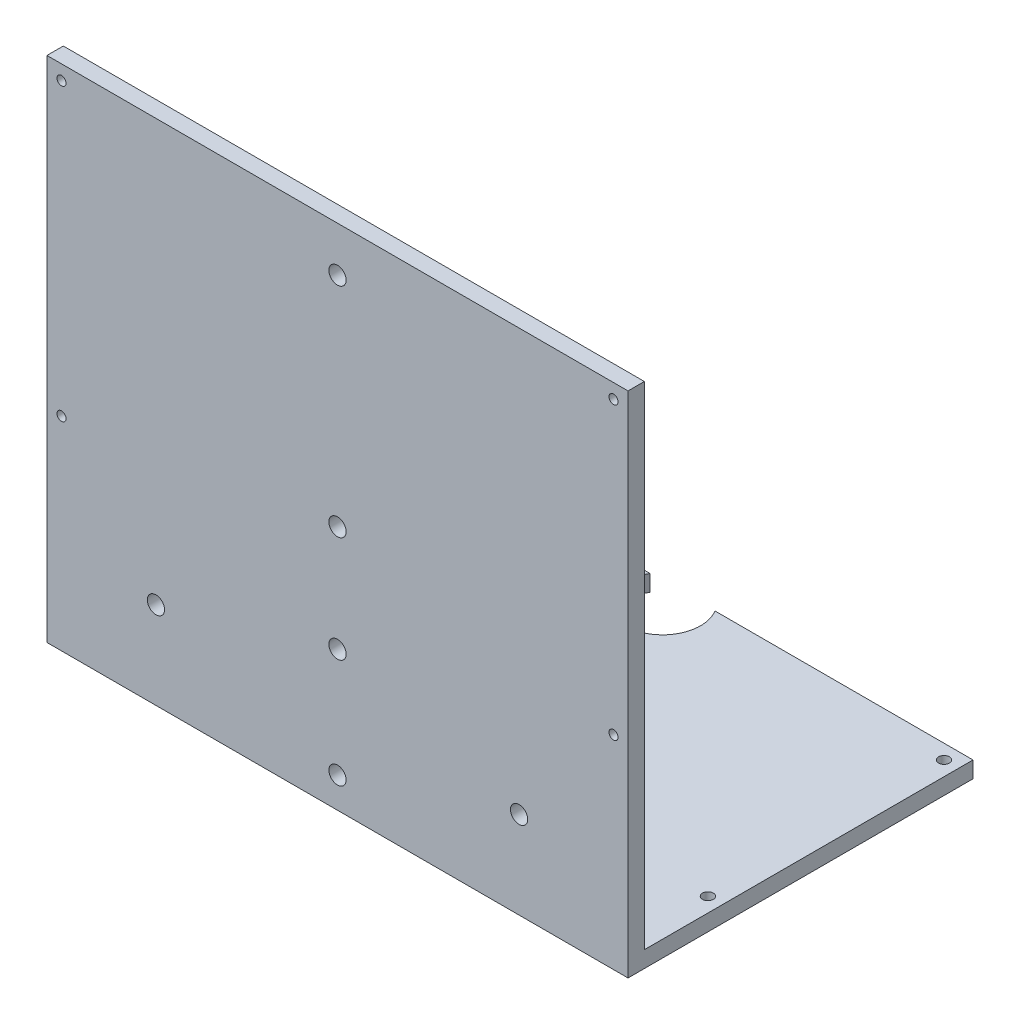
from build123d import *

# Parameters (mm, degrees)
SKETCH1_W           = 160
SKETCH1_H           = 95
BOSS_EXTRUDE1_DEPTH = 4.5
SKETCH2_R           = 1.5
CUT_EXTRUDE1_DEPTH  = 5
SKETCH5_W           = 160
SKETCH5_H           = 4.5
BOSS_EXTRUDE2_DEPTH = 135.5
SKETCH7_R           = 1.25
CUT_EXTRUDE2_DEPTH  = 5
SKETCH9_R           = 10.5
SKETCH9_R_2         = 5
SKETCH9_R_3         = 1.4
CUT_EXTRUDE3_DEPTH  = 5
SKETCH10_R          = 2.375
CUT_EXTRUDE4_DEPTH  = 10


with BuildPart() as part:
    # Sketch1 → Boss-Extrude1 (new body)
    with BuildSketch(Plane(origin=(0, 0, 0), x_dir=(1, 0, 0), z_dir=(0, 1, 0))):
        Rectangle(SKETCH1_W, SKETCH1_H)
    extrude(amount=BOSS_EXTRUDE1_DEPTH)

    # Sketch2 → Cut-Extrude1 (cut)
    with BuildSketch(Plane(origin=(0, 4.5, 0), x_dir=(1, 0, 0), z_dir=(0, 1, 0))):
        with Locations(Location((76, -21.5, 0), (0, 0, 270))):
            Circle(SKETCH2_R)
        with Locations(Location((-76, -21.5, 0), (0, 0, 270))):
            Circle(SKETCH2_R)
        with Locations(Location((-76, 43.5, 0), (0, 0, 270))):
            Circle(SKETCH2_R)
        with Locations(Location((76, 43.5, 0), (0, 0, 270))):
            Circle(SKETCH2_R)
    extrude(amount=-CUT_EXTRUDE1_DEPTH, mode=Mode.SUBTRACT)

    # Sketch5 → Boss-Extrude2 (add)
    with BuildSketch(Plane(origin=(0, 4.5, 0), x_dir=(1, 0, 0), z_dir=(0, 1, 0))):
        with Locations((0, -45.25)):
            Rectangle(SKETCH5_W, SKETCH5_H)
    extrude(amount=BOSS_EXTRUDE2_DEPTH)

    # Sketch7 → Cut-Extrude2 (cut)
    with BuildSketch(Plane(origin=(0, 0, 43), x_dir=(-1, 0, 0), z_dir=(0, 0, -1))):
        with Locations((76, 136)):
            Circle(SKETCH7_R)
        with Locations((-76, 136)):
            Circle(SKETCH7_R)
        with Locations((-76, 56)):
            Circle(SKETCH7_R)
        with Locations((76, 56)):
            Circle(SKETCH7_R)
    extrude(amount=-CUT_EXTRUDE2_DEPTH, mode=Mode.SUBTRACT)

    # Sketch9 → Cut-Extrude3 (cut)
    with BuildSketch(Plane(origin=(0, 4.5, 0), x_dir=(1, 0, 0), z_dir=(0, 1, 0))):
        with Locations((0, 42)):
            Circle(SKETCH9_R)
        with Locations(Location((-45.917706268, 40.60591365, 0), (0, 0, 270))):
            Circle(SKETCH9_R_2)
        with Locations(Location((-28.55, 43.75, 0), (0, 0, 270))):
            Circle(SKETCH9_R_3)
        with Locations(Location((-55.25, 30.17, 0), (0, 0, 270))):
            Circle(SKETCH9_R_3)
    extrude(amount=-CUT_EXTRUDE3_DEPTH, mode=Mode.SUBTRACT)

    # Sketch10 → Cut-Extrude4 (cut)
    with BuildSketch(Plane(origin=(0, 0, 43), x_dir=(-1, 0, 0), z_dir=(0, 0, -1))):
        with Locations((0, 8.4)):
            Circle(SKETCH10_R)
        with Locations((0, 38.4)):
            Circle(SKETCH10_R)
        with Locations((0, 67.6)):
            Circle(SKETCH10_R)
        with Locations((0, 127.6)):
            Circle(SKETCH10_R)
        with Locations((-50, 24)):
            Circle(SKETCH10_R)
        with Locations((50, 24)):
            Circle(SKETCH10_R)
    extrude(amount=-CUT_EXTRUDE4_DEPTH, mode=Mode.SUBTRACT)


solid = part.part
